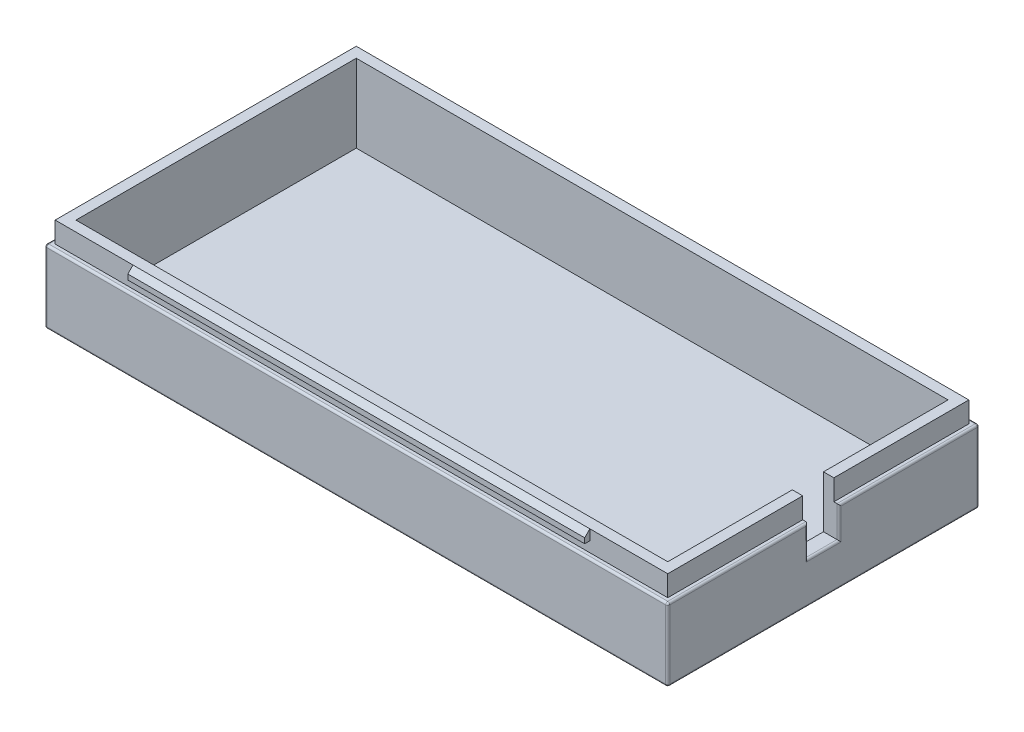
from build123d import *

# Parameters (mm, degrees)
SKETCH_1_W                 = 60
SKETCH_1_H                 = 30
EXTRUDE_1_DEPTH            = 7
SKETCH_2_W                 = 59
SKETCH_2_H                 = 29
EXTRUDE_2_DEPTH            = 2
SKETCH_3_W                 = 57
SKETCH_3_H                 = 27
CUT_EXTRUDE_1_DEPTH        = 7.5
SKETCH_4_W                 = 44
SKETCH_4_H                 = 1
EXTRUDE_3_DEPTH            = 0.5
CHAMFER_1_SIZE             = 0.5
CHAMFER_1_OF_MIRROR_1_SIZE = 0.5
CUT_EXTRUDE_2_DEPTH        = 5
FILLET_1_R                 = 0.2


with BuildPart() as part:
    # 草图1 → 凸台-拉伸1 (new body)
    with BuildSketch(Plane(origin=(0, 0, 0), x_dir=(1, 0, 0), z_dir=(0, 1, 0))):
        Rectangle(SKETCH_1_W, SKETCH_1_H)
    extrude(amount=EXTRUDE_1_DEPTH)

    # 草图2 → 凸台-拉伸2 (add)
    with BuildSketch(Plane(origin=(0, 7, 0), x_dir=(1, 0, 0), z_dir=(0, 1, 0))):
        Rectangle(SKETCH_2_W, SKETCH_2_H)
    extrude(amount=EXTRUDE_2_DEPTH)

    # 草图3 → 切除-拉伸1 (cut)
    with BuildSketch(Plane(origin=(0, 9, 0), x_dir=(1, 0, 0), z_dir=(0, 1, 0))):
        Rectangle(SKETCH_3_W, SKETCH_3_H)
    extrude(amount=-CUT_EXTRUDE_1_DEPTH, mode=Mode.SUBTRACT)

    # 草图4 → 凸台-拉伸3 (add)
    with BuildSketch(Plane(origin=(0, 0, -14.5), x_dir=(-1, 0, 0), z_dir=(0, 0, -1))):
        with Locations((0, 8.5)):
            Rectangle(SKETCH_4_W, SKETCH_4_H)
    extrude_3 = extrude(amount=EXTRUDE_3_DEPTH)

    # 倒角1
    chamfer_1_edges = [part.edges().sort_by_distance(p)[0] for p in [
        (0, 9, -15),
    ]]
    chamfer(chamfer_1_edges, length=CHAMFER_1_SIZE)

    # 镜向1: 凸台-拉伸3 across plane
    add(extrude_3.mirror(Plane.XY))

    # 倒角1 of 镜向1
    chamfer_1_of_mirror_1_edges = [part.edges().sort_by_distance(p)[0] for p in [
        (0, 9, 15),
    ]]
    chamfer(chamfer_1_of_mirror_1_edges, length=CHAMFER_1_OF_MIRROR_1_SIZE)

    # 草图5 → 切除-拉伸2 (cut)
    with BuildSketch(Plane(origin=(0, 9, 0), x_dir=(1, 0, 0), z_dir=(0, 1, 0))):
        Polygon((30, 0), (30, 1.5), (28.5, 1.5), (28.5, -1.5), (30, -1.5), align=None)
    extrude(amount=-CUT_EXTRUDE_2_DEPTH, mode=Mode.SUBTRACT)

    # 圆角1
    fillet_1_edges = [part.edges().sort_by_distance(p)[0] for p in [
        (0, 7, 15),
        (30, 7, 8.25),
        (0, 7, -15),
        (30, 0, 0),
        (0, 0, 15),
        (-30, 0, 0),
        (0, 0, -15),
        (-30, 7, 0),
        (30, 3.5, -15),
        (30, 3.5, 15),
        (-30, 3.5, 15),
        (-30, 3.5, -15),
        (30, 7, -8.25),
        (30, 5.5, 1.5),
        (30, 4, 0),
        (30, 5.5, -1.5),
    ]]
    fillet(fillet_1_edges, radius=FILLET_1_R)


solid = part.part
